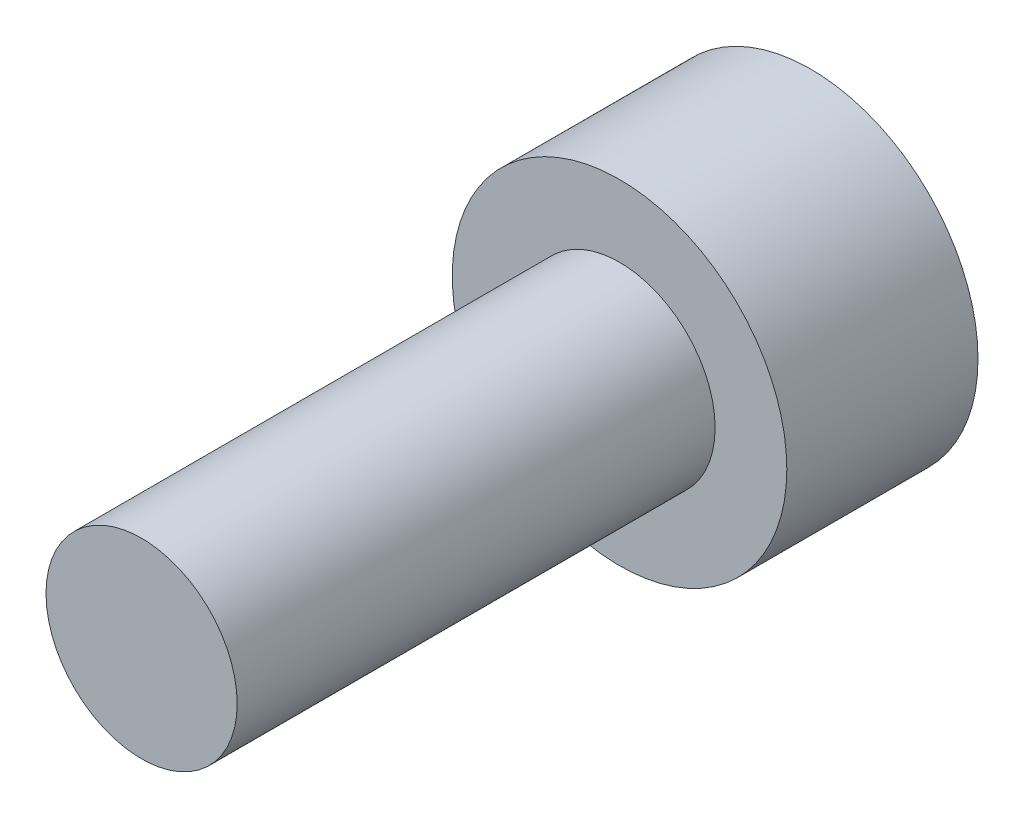
from build123d import *

# Parameters (mm, degrees)
SKETCH_1_R          = 3.5
EXTRUDE_1_DEPTH     = 4
SKETCH_2_R          = 2
EXTRUDE_2_DEPTH     = 10
CUT_EXTRUDE_1_DEPTH = 2


with BuildPart() as part:
    # ｽｹｯﾁ1 → ﾎﾞｽ - 押し出し1 (new body)
    with BuildSketch(Plane.XY):
        Circle(SKETCH_1_R)
    extrude(amount=EXTRUDE_1_DEPTH)

    # ｽｹｯﾁ2 → ﾎﾞｽ - 押し出し2 (add)
    with BuildSketch(Plane.XY.offset(4)):
        Circle(SKETCH_2_R)
    extrude(amount=EXTRUDE_2_DEPTH)

    # ｽｹｯﾁ3 → ｶｯﾄ - 押し出し1 (cut)
    with BuildSketch(Plane(origin=(0, 0, 0), x_dir=(-1, 0, 0), z_dir=(0, 0, -1))):
        Polygon((1.704102498, -0.946321786), (1.671589956, 1.002635161), (-0.032512542, 1.948956947), (-1.704102498, 0.946321786), (-1.671589956, -1.002635161), (0.032512542, -1.948956947), align=None)
    extrude(amount=-CUT_EXTRUDE_1_DEPTH, mode=Mode.SUBTRACT)


solid = part.part
